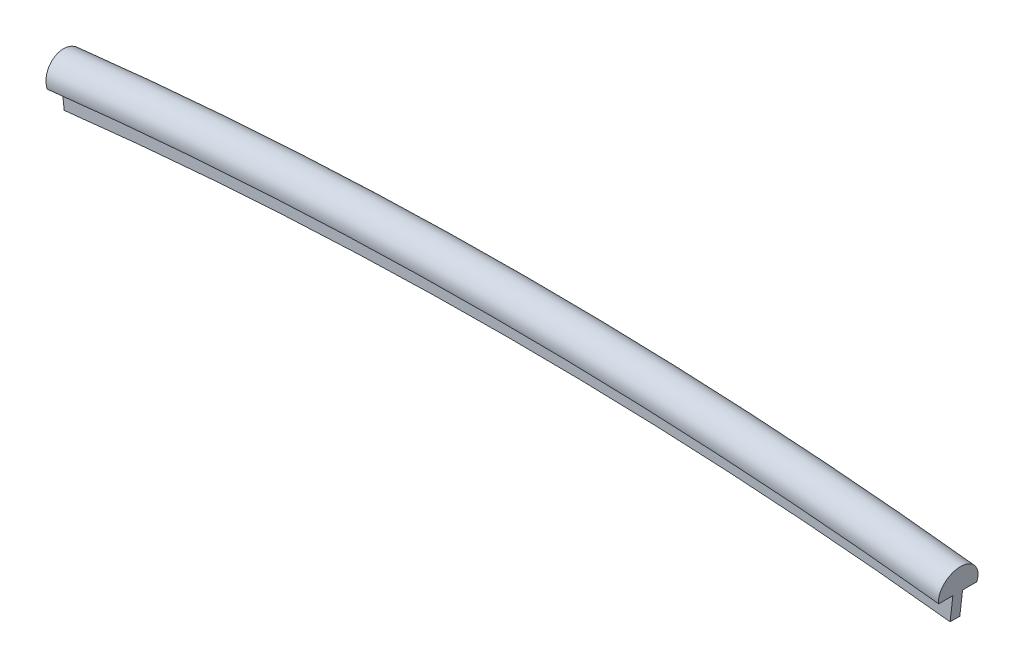
from build123d import *

# Parameters (mm, degrees)
REVOLVE1_ANGLE           = 6.563019823
REVOLVE1_OTHER_WAY_ANGLE = 6.563019823


with BuildPart() as part:
    # Sketch2 → Revolve1 (revolve)
    with BuildSketch(Plane(origin=(0, 0, 0), x_dir=(0, 0, -1), z_dir=(1, 0, 0))):
        with BuildLine():
            Line((0, 239.8), (0.3, 239.8))
            Line((0.3, 239.8), (0.3, 241.3))
            Line((0.3, 241.3), (1.18, 241.3))
            ThreePointArc((1.18, 241.3), (0, 242.800182019), (-1.18, 241.3))
            Line((-1.18, 241.3), (-0.3, 241.3))
            Line((-0.3, 241.3), (-0.3, 239.8))
            Line((-0.3, 239.8), (0, 239.8))
        make_face()
    revolve(axis=Axis((0, 0, 70.597641597), (0, 0, -1)), revolution_arc=REVOLVE1_ANGLE)

    # Sketch2 → Revolve1 other way (revolve)
    with BuildSketch(Plane(origin=(0, 0, 0), x_dir=(0, 0, -1), z_dir=(1, 0, 0))):
        with BuildLine():
            Line((0, 239.8), (0.3, 239.8))
            Line((0.3, 239.8), (0.3, 241.3))
            Line((0.3, 241.3), (1.18, 241.3))
            ThreePointArc((1.18, 241.3), (0, 242.800182019), (-1.18, 241.3))
            Line((-1.18, 241.3), (-0.3, 241.3))
            Line((-0.3, 241.3), (-0.3, 239.8))
            Line((-0.3, 239.8), (0, 239.8))
        make_face()
    revolve(axis=Axis((0, 0, 70.597641597), (0, 0, 1)), revolution_arc=REVOLVE1_OTHER_WAY_ANGLE)


solid = part.part
